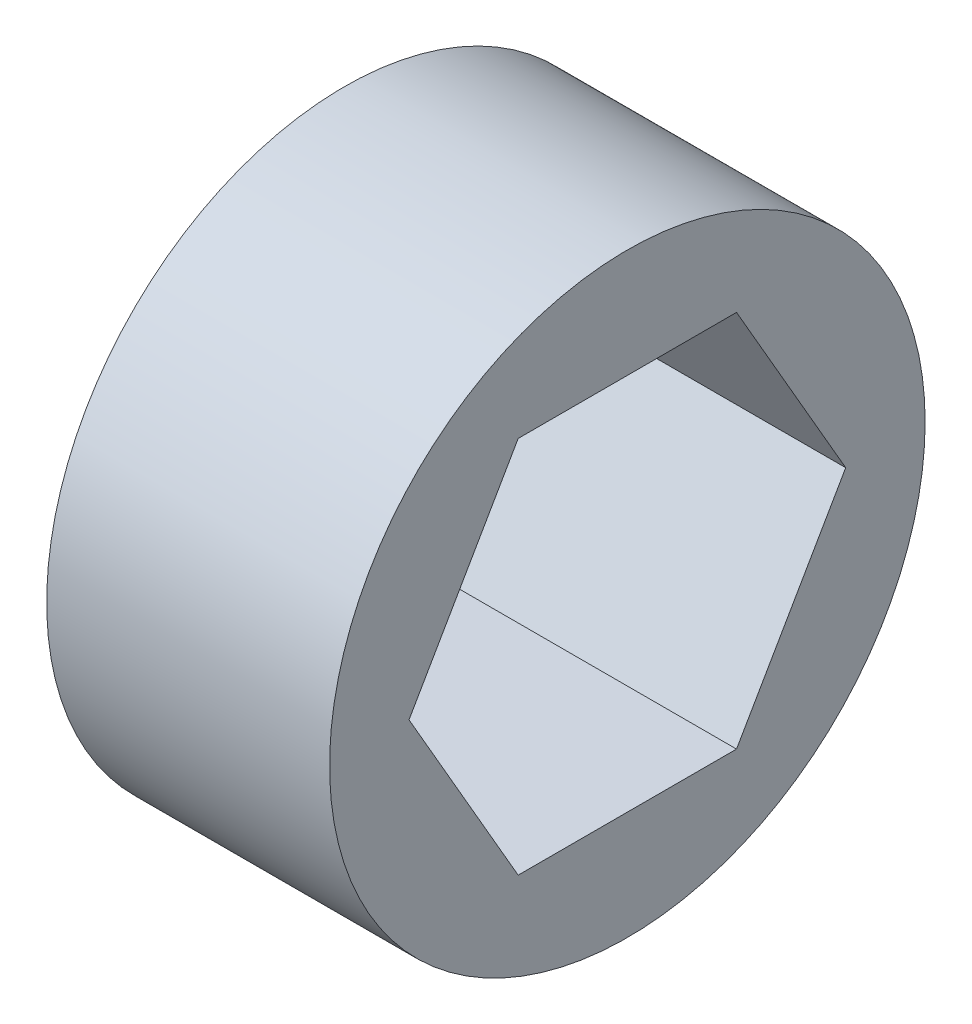
from build123d import *

# Parameters (mm, degrees)
CROQUIS1_R              = 10
SALIENTE_EXTRUIR1_DEPTH = 9.5


with BuildPart() as part:
    # Croquis1 → Saliente-Extruir1 (new body)
    with BuildSketch(Plane(origin=(0, 0, 0), x_dir=(0, 0, -1), z_dir=(1, 0, 0))):
        Circle(CROQUIS1_R)
        Polygon((7.332348419, 0), (3.666174209, 6.35), (-3.666174209, 6.35), (-7.332348419, 0), (-3.666174209, -6.35), (3.666174209, -6.35), align=None, mode=Mode.SUBTRACT)
    extrude(amount=SALIENTE_EXTRUIR1_DEPTH)


solid = part.part
